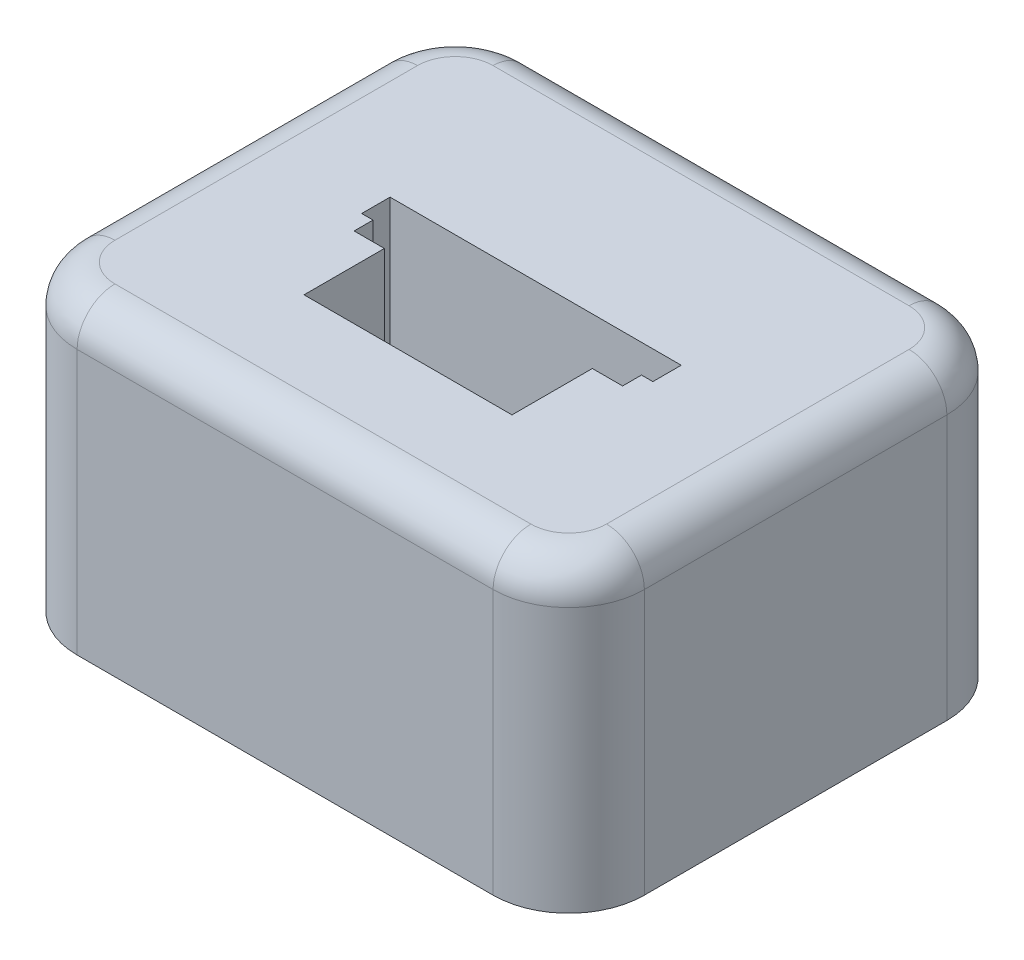
from build123d import *

# Parameters (mm, degrees)
EXTRUDE_392_DEPTH      = 16
FILLET_1_R             = 2
SKETCH_6_R             = 0.9
CUT_EXTRUDE_1038_DEPTH = 7
CUT_EXTRUDE_1432_REACH = 43.617
SKETCH_3_W             = 11
SKETCH_3_H             = 3
SKETCH_2_W             = 15.4
SKETCH_2_H             = 1.5
CUT_EXTRUDE_1918_DEPTH = 8
SKETCH_7_W             = 11
SKETCH_7_H             = 2.25
CUT_EXTRUDE_2_DEPTH    = 7.5
SKETCH_8_W             = 14.2
SKETCH_8_H             = 1
CUT_EXTRUDE_3_DEPTH    = 6.5


with BuildPart() as part:
    # Эскиз1 → Extrude 392 (new body)
    with BuildSketch(Plane(origin=(0, 0, 0), x_dir=(1, 0, 0), z_dir=(0, 1, 0))):
        with BuildLine():
            Line((4, 0), (26, 0))
            ThreePointArc((26, 0), (28.828427125, 1.171572875), (30, 4))
            Line((30, 4), (30, 20))
            ThreePointArc((30, 20), (28.828427125, 22.828427125), (26, 24))
            Line((26, 24), (4, 24))
            ThreePointArc((4, 24), (1.171572875, 22.828427125), (0, 20))
            Line((0, 20), (0, 4))
            ThreePointArc((0, 4), (1.171572875, 1.171572875), (4, 0))
        make_face()
    extrude(amount=EXTRUDE_392_DEPTH)

    # Скругление1
    fillet_1_edges = [part.edges().sort_by_distance(p)[0] for p in [
        (1.171572875, 16, -22.828427125),
        (0, 16, -12),
        (1.171572875, 16, -1.171572875),
        (15, 16, 0),
        (28.828427125, 16, -1.171572875),
        (30, 16, -12),
        (28.828427125, 16, -22.828427125),
        (15, 16, -24),
    ]]
    fillet(fillet_1_edges, radius=FILLET_1_R)

    # Эскиз6 → Cut-Extrude 1038 (cut)
    with BuildSketch(Plane.XZ):
        with Locations(Location((4, -4, 0), (0, 0, 270))):
            Circle(SKETCH_6_R)
        with Locations(Location((26, -4, 0), (0, 0, 270))):
            Circle(SKETCH_6_R)
        with Locations(Location((26, -20, 0), (0, 0, 270))):
            Circle(SKETCH_6_R)
        with Locations(Location((4, -20, 0), (0, 0, 270))):
            Circle(SKETCH_6_R)
    extrude(amount=-CUT_EXTRUDE_1038_DEPTH, mode=Mode.SUBTRACT)

    # Эскиз3 → Cut-Extrude 1432 (cut, up to next)
    with BuildSketch(Plane(origin=(0, 16, 0), x_dir=(1, 0, 0), z_dir=(0, 1, 0)), mode=Mode.PRIVATE) as cut_extrude_1432_sk1:
        with Locations((15, 8)):
            Rectangle(SKETCH_3_W, SKETCH_3_H)
    cut_extrude_1432_tool1 = extrude(cut_extrude_1432_sk1.sketch, amount=-CUT_EXTRUDE_1432_REACH, mode=Mode.PRIVATE) & part.part
    add(cut_extrude_1432_tool1.solids().sort_by_distance((15, 16, -8))[0], mode=Mode.SUBTRACT)

    # Эскиз2 → Cut-Extrude 1918 (cut)
    with BuildSketch(Plane(origin=(0, 16, 0), x_dir=(1, 0, 0), z_dir=(0, 1, 0))):
        with Locations((15, 12.5)):
            Rectangle(SKETCH_2_W, SKETCH_2_H)
    extrude(amount=-CUT_EXTRUDE_1918_DEPTH, mode=Mode.SUBTRACT)

    # Эскиз7 → Вырез-Вытянуть2 (cut)
    with BuildSketch(Plane(origin=(0, 16, 0), x_dir=(1, 0, 0), z_dir=(0, 1, 0))):
        with Locations((15, 10.625)):
            Rectangle(SKETCH_7_W, SKETCH_7_H)
    extrude(amount=-CUT_EXTRUDE_2_DEPTH, mode=Mode.SUBTRACT)

    # Эскиз8 → Вырез-Вытянуть3 (cut)
    with BuildSketch(Plane(origin=(0, 16, 0), x_dir=(1, 0, 0), z_dir=(0, 1, 0))):
        with Locations((15, 11.25)):
            Rectangle(SKETCH_8_W, SKETCH_8_H)
    extrude(amount=-CUT_EXTRUDE_3_DEPTH, mode=Mode.SUBTRACT)


solid = part.part
